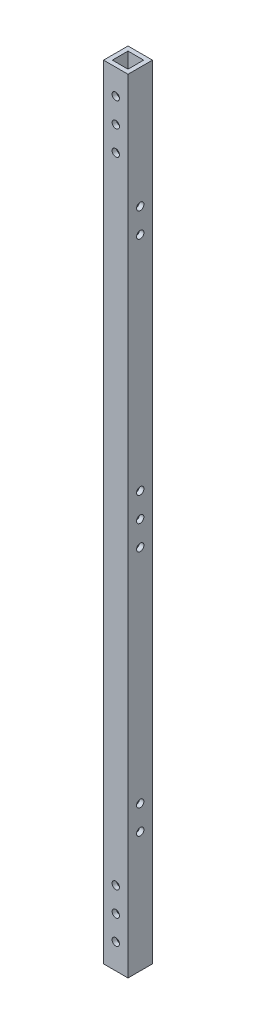
from build123d import *

# Parameters (mm, degrees)
SKETCH_1_W          = 10
SKETCH_1_H          = 10
SKETCH_1_W_2        = 6.4
SKETCH_1_H_2        = 6.4
EXTRUDE_1_DEPTH     = 160
SKETCH_2_R          = 1.5
CUT_EXTRUDE_1_DEPTH = 161.390149323
SKETCH_3_R          = 1.5
CUT_EXTRUDE_2_DEPTH = 161.390149323
SKETCH_4_R          = 1.5
CUT_EXTRUDE_3_DEPTH = 161.390149323


with BuildPart() as part:
    # 草图1 → 凸台-拉伸1 (new, symmetric)
    with BuildSketch(Plane(origin=(0, 0, 0), x_dir=(1, 0, 0), z_dir=(0, 1, 0))):
        Rectangle(SKETCH_1_W, SKETCH_1_H)
        Rectangle(SKETCH_1_W_2, SKETCH_1_H_2, mode=Mode.SUBTRACT)
    extrude(amount=EXTRUDE_1_DEPTH, both=True)

    # 草图2 → 切除-拉伸1 (cut, through all)
    with BuildSketch(Plane(origin=(0, 0, -5), x_dir=(-1, 0, 0), z_dir=(0, 0, -1))):
        with Locations((0, -149.7)):
            Circle(SKETCH_2_R)
        with Locations((0, -139.7)):
            Circle(SKETCH_2_R)
        with Locations((0, -129.7)):
            Circle(SKETCH_2_R)
        with Locations((0, 139.7)):
            Circle(SKETCH_2_R)
        with Locations((0, 149.7)):
            Circle(SKETCH_2_R)
        with Locations((0, 129.7)):
            Circle(SKETCH_2_R)
    extrude(amount=-CUT_EXTRUDE_1_DEPTH, mode=Mode.SUBTRACT)

    # 草图3 → 切除-拉伸2 (cut, through all)
    with BuildSketch(Plane.ZY.offset(5)):
        with Locations((0, -110.7)):
            Circle(SKETCH_3_R)
        with Locations((0, -100.7)):
            Circle(SKETCH_3_R)
        with Locations(Location((0, 100.7, 0), (0, 0, 180))):
            Circle(SKETCH_3_R)
        with Locations(Location((0, 110.7, 0), (0, 0, 180))):
            Circle(SKETCH_3_R)
    extrude(amount=-CUT_EXTRUDE_2_DEPTH, mode=Mode.SUBTRACT)

    # 草图4 → 切除-拉伸3 (cut, through all)
    with BuildSketch(Plane(origin=(5, 0, 0), x_dir=(0, 0, -1), z_dir=(1, 0, 0))):
        Circle(SKETCH_4_R)
        with Locations((0, -10)):
            Circle(SKETCH_4_R)
        with Locations((0, 10)):
            Circle(SKETCH_4_R)
    extrude(amount=-CUT_EXTRUDE_3_DEPTH, mode=Mode.SUBTRACT)


solid = part.part
